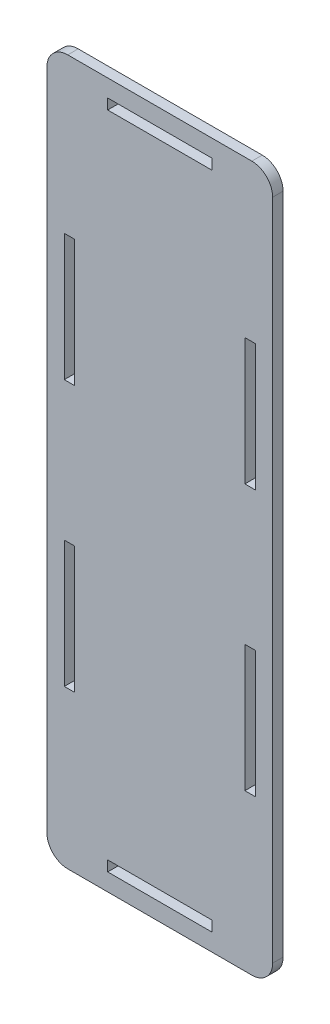
from build123d import *

# Parameters (mm, degrees)
BOSS_EXTRUDE1_DEPTH = 3
SKETCH2_W           = 3
SKETCH2_H           = 36.5
SKETCH2_W_2         = 30
SKETCH2_H_2         = 3
CUT_EXTRUDE1_DEPTH  = 3


with BuildPart() as part:
    # Sketch1 → Boss-Extrude1 (new body)
    with BuildSketch(Plane.XY):
        with BuildLine():
            Line((-26.5, 101.5), (26.5, 101.5))
            ThreePointArc((26.5, 101.5), (30.742640687, 99.742640687), (32.5, 95.5))
            Line((32.5, 95.5), (32.5, -95.5))
            ThreePointArc((32.5, -95.5), (30.742640687, -99.742640687), (26.5, -101.5))
            Line((26.5, -101.5), (-26.5, -101.5))
            ThreePointArc((-26.5, -101.5), (-30.742640687, -99.742640687), (-32.5, -95.5))
            Line((-32.5, -95.5), (-32.5, 95.5))
            ThreePointArc((-32.5, 95.5), (-30.742640687, 99.742640687), (-26.5, 101.5))
        make_face()
    extrude(amount=BOSS_EXTRUDE1_DEPTH)

    # Sketch2 → Cut-Extrude1 (cut)
    with BuildSketch(Plane.XY.offset(3)):
        with Locations((26, -38.25)):
            Rectangle(SKETCH2_W, SKETCH2_H)
        with Locations((0, 95)):
            Rectangle(SKETCH2_W_2, SKETCH2_H_2)
        with Locations((26, 38.25)):
            Rectangle(SKETCH2_W, SKETCH2_H)
        with Locations((0, -95)):
            Rectangle(SKETCH2_W_2, SKETCH2_H_2)
        with Locations((-26, 38.25)):
            Rectangle(SKETCH2_W, SKETCH2_H)
        with Locations((-26, -38.25)):
            Rectangle(SKETCH2_W, SKETCH2_H)
    extrude(amount=-CUT_EXTRUDE1_DEPTH, mode=Mode.SUBTRACT)


solid = part.part
